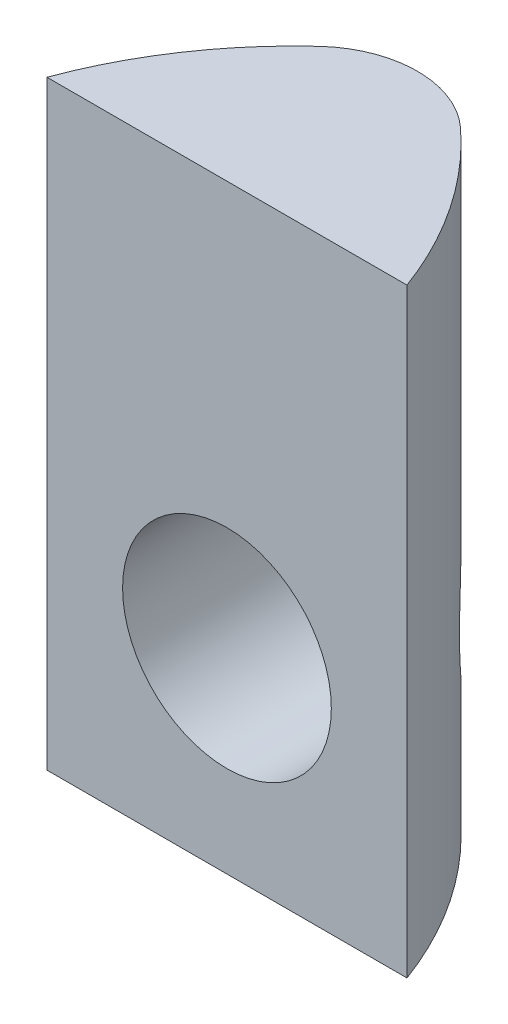
from build123d import *

# Parameters (mm, degrees)
BOSS_EXTRUDE1_DEPTH      = 23
F_8_0_8_DIAMETER_HOLE1_D = 8
FILLET1_R                = 3.99999999


with BuildPart() as part:
    # Sketch1 → Boss-Extrude1 (new body)
    with BuildSketch(Plane.XZ.offset(7.5)):
        with BuildLine():
            Line((6.9, 0), (-6.9, 0))
            ThreePointArc((-6.9, 0), (-4.163490138, -4.720459639), (-3e-09, -8.247012535))
            ThreePointArc((-3e-09, -8.247012535), (4.163490136, -4.720459641), (6.9, 0))
        make_face()
    extrude(amount=-BOSS_EXTRUDE1_DEPTH)

    # Ø8.0 (8) Diameter Hole1 (through all)
    with Locations(Plane.XY):
        with Locations((0, 0)):
            Hole(F_8_0_8_DIAMETER_HOLE1_D / 2)

    # Fillet1
    fillet1_edges = [part.edges().sort_by_distance(p)[0] for p in [
        (-3e-09, 9.75, -8.247012535),
        (-3e-09, -5.75, -8.247012535),
    ]]
    fillet(fillet1_edges, radius=FILLET1_R)


solid = part.part
